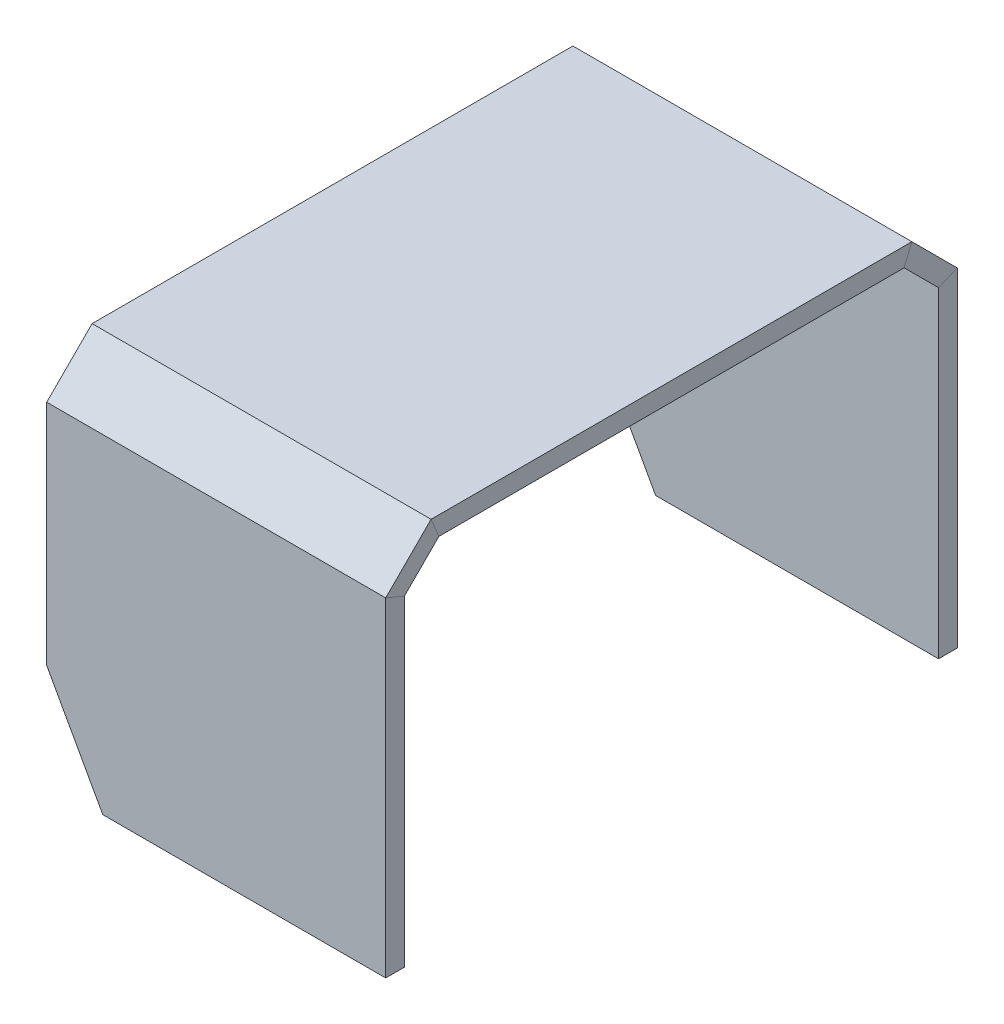
from build123d import *

# Parameters (mm, degrees)
SKETCH1_W           = 73.5
SKETCH1_H           = 5
BOSS_EXTRUDE1_DEPTH = 17
CUT_EXTRUDE1_DEPTH  = 195.359872402


with BuildPart() as part:
    # Sweep3: sweep along a path in Sketch2
    with BuildLine(Plane(origin=(0, 0, 0), x_dir=(0, 0, -1), z_dir=(1, 0, 0))) as sweep3_path:
        Line((-73.8, 0), (-73.8, 86.85))
        Line((-73.8, 86.85), (-63.15, 97.5))
        Line((-63.15, 97.5), (63.15, 97.5))
        Line((63.15, 97.5), (73.8, 86.85))
        Line((73.8, 86.85), (73.8, 0))
    # Sketch1 → Sweep3 (sweep)
    with BuildSketch(Plane(origin=(0, 0, 0), x_dir=(1, 0, 0), z_dir=(0, 1, 0))):
        with Locations((-13.25, -73.8)):
            Rectangle(SKETCH1_W, SKETCH1_H)
    sweep(path=sweep3_path.line, transition=Transition.RIGHT)

    # Sketch5 → Boss-Extrude1 (add)
    with BuildSketch(Plane.ZY.offset(50)):
        Polygon((-76.3, 0), (-71.3, 0), (-71.3, 85.814466094), (-62.114466094, 95), (62.114466094, 95), (71.3, 85.814466094), (71.3, 0), (76.3, 0), (76.3, 87.885533906), (64.185533906, 100), (-64.185533906, 100), (-76.3, 87.885533906), align=None)
    extrude(amount=BOSS_EXTRUDE1_DEPTH)

    # Sketch6 → Cut-Extrude1 (cut, through all)
    with BuildSketch(Plane(origin=(0, 0, -76.3), x_dir=(-1, 0, 0), z_dir=(0, 0, -1))):
        Polygon((52.03, 0), (67, 27), (67, 0), align=None)
    extrude(amount=-CUT_EXTRUDE1_DEPTH, mode=Mode.SUBTRACT)


solid = part.part
